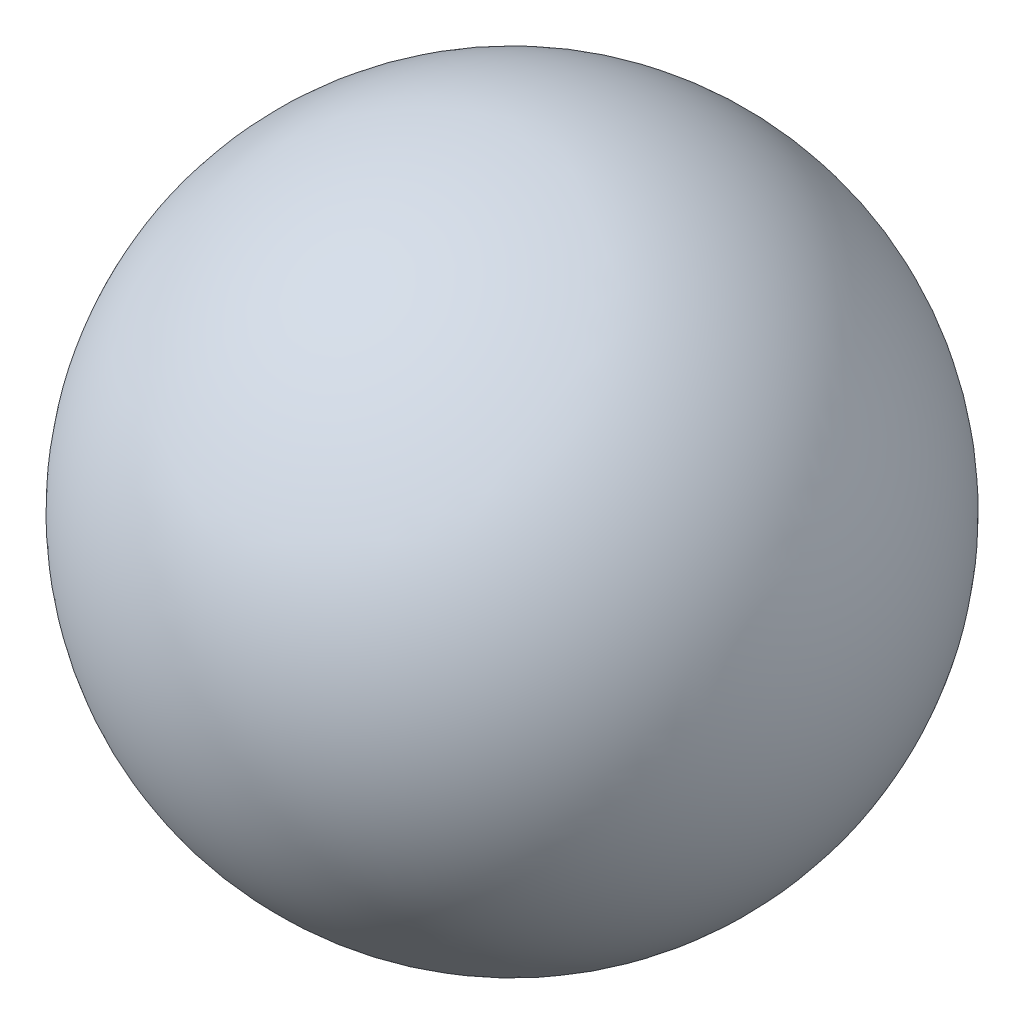
from build123d import *


with BuildPart() as part:
    # 草图1 → 旋转6 (revolve)
    with BuildSketch(Plane.XY):
        with BuildLine():
            Line((13, 0), (-13, 0))
            ThreePointArc((-13, 0), (0, 13), (13, 0))
        make_face()
    revolve(axis=Axis((13, 0, 0), (-1, 0, 0)))


solid = part.part
